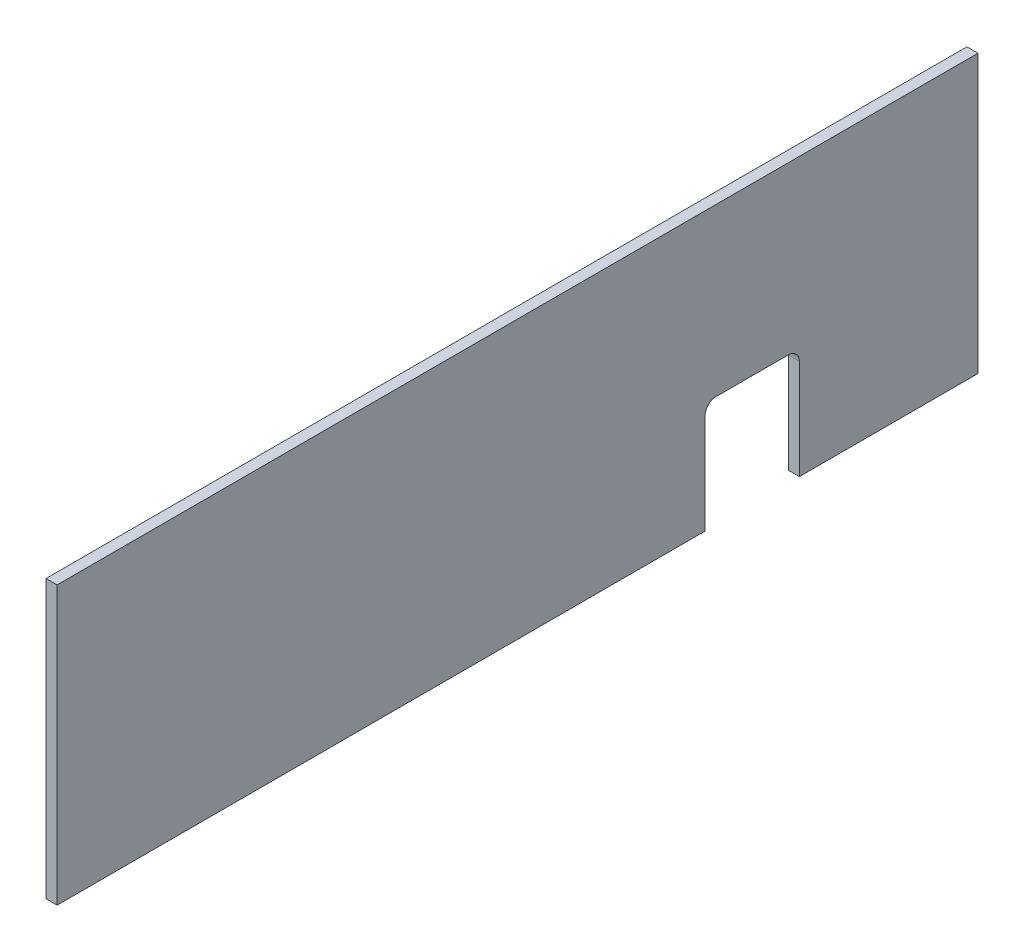
from build123d import *

# Parameters (mm, degrees)
BOSS_EXTRUDE1_DEPTH = 1
FILLET1_R           = 1


with BuildPart() as part:
    # Sketch1 → Boss-Extrude1 (new body)
    with BuildSketch(Plane(origin=(0, 0, 0), x_dir=(0, 0, -1), z_dir=(1, 0, 0))):
        Polygon((-41.5, 12.5), (-41.5, -12.5), (16.9, -12.5), (16.9, -2.5), (25.4, -2.5), (25.4, -12.5), (41.5, -12.5), (41.5, 12.5), align=None)
    extrude(amount=BOSS_EXTRUDE1_DEPTH)

    # Fillet1
    fillet1_edges = [part.edges().sort_by_distance(p)[0] for p in [
        (0.5, -2.5, -25.4),
        (0.5, -2.5, -16.9),
    ]]
    fillet(fillet1_edges, radius=FILLET1_R)


solid = part.part
